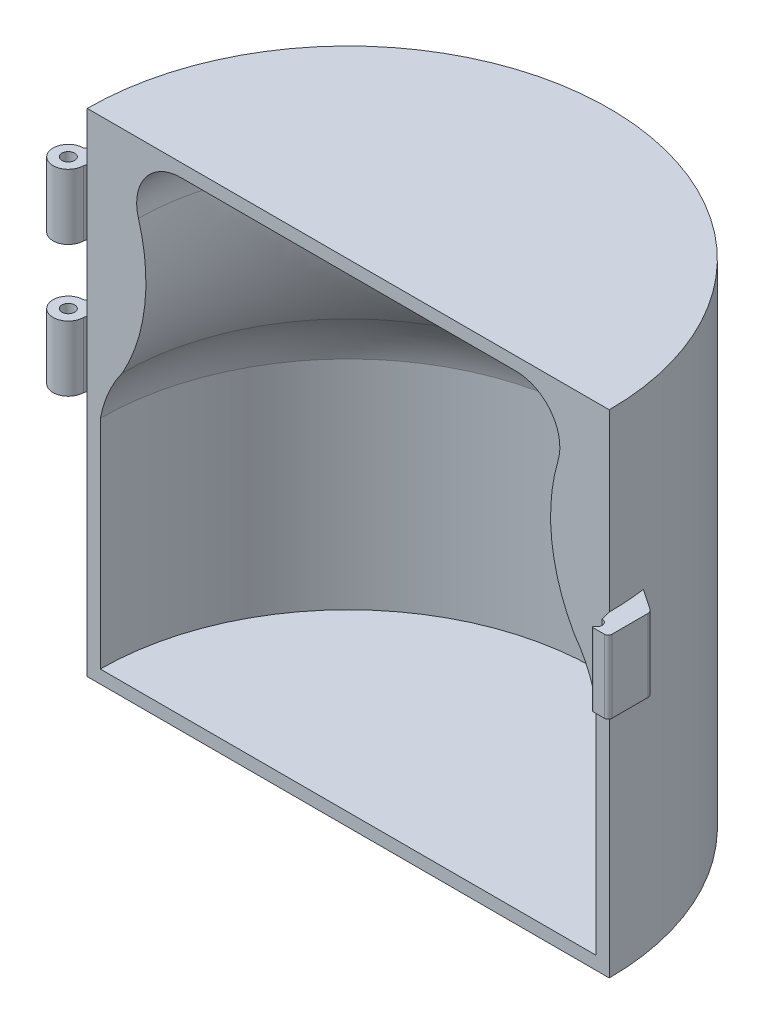
from build123d import *
from build123d.topology import SkipClean

# Parameters (mm, degrees)
REVOLVE1_ANGLE               = 180
BOSS_EXTRUDE1_DEPTH          = 22
BOSS_EXTRUDE1_DEPTH_BACK     = 5
SKETCH3_R                    = 0.875
BOSS_EXTRUDE2_DEPTH          = 5
BOSS_EXTRUDE2_DEPTH_BACK     = 5
SKETCH4_W                    = 4.7
SKETCH4_H                    = 9.1
CUT_REVOLVE1_ANGLE           = 9
CUT_REVOLVE1_OTHER_WAY_ANGLE = 9


with BuildPart() as part:
    # Sketch1 → Revolve1 (revolve)
    with BuildSketch(Plane.XY):
        with BuildLine():
            Line((0, 27.259159134), (23.011868121, 27.259159134))
            ThreePointArc((23.011868121, 27.259159134), (27.855738892, 24.833992365), (28.816239605, 19.502767713))
            ThreePointArc((28.816239605, 19.502767713), (27.949144344, 9.543519717), (31.011361688, 0.027149624))
            ThreePointArc((31.011361688, 0.027149624), (32.915416284, -3.265823742), (34.05, -6.89650099))
            Line((34.05, -6.89650099), (34.05, -36.726991211))
            Line((34.05, -36.726991211), (0, -36.726991211))
            Line((0, -36.726991211), (0, -38.526991211))
            Line((0, -38.526991211), (35.85, -38.526991211))
            Line((35.85, -38.526991211), (35.85, 29.059159134))
            Line((35.85, 29.059159134), (0, 29.059159134))
            Line((0, 29.059159134), (0, 27.259159134))
        make_face()
    revolve(axis=Axis((0, 0, 0), (0, 1, 0)), revolution_arc=REVOLVE1_ANGLE)

    # Sketch3 → Boss-Extrude1 (add, two sides: drawn at the far end of the back side and taken through both)
    with BuildSketch(Plane(origin=(0, 0, 0), x_dir=(1, 0, 0), z_dir=(0, 1, 0)).offset(-BOSS_EXTRUDE1_DEPTH_BACK)):
        with BuildLine():
            Line((-35.835435362, 1.02179861), (-35.66522342, 1.724252792))
            Line((-35.66522342, 1.724252792), (-35.552792373, 4.606674994))
            ThreePointArc((-35.552792373, 4.606674994), (-36.966498022, 3.313002301), (-38.45, 2.1))
            ThreePointArc((-38.45, 2.1), (-39.934924016, -1.484924465), (-36.35, 6.34e-07))
            ThreePointArc((-36.35, 6.34e-07), (-36.156829024, 0.54318529), (-35.835435362, 1.02179861))
        make_face()
        with Locations(Location((-38.45, 0, 0), (0, 0, 270))):
            Circle(SKETCH3_R, mode=Mode.SUBTRACT)
    extrude(amount=BOSS_EXTRUDE1_DEPTH + BOSS_EXTRUDE1_DEPTH_BACK)

    # Sketch5 → Boss-Extrude2 (add, two sides: drawn at the far end of the back side and taken through both)
    with BuildSketch(Plane(origin=(0, 0, 0), x_dir=(1, 0, 0), z_dir=(0, 1, 0)).offset(-BOSS_EXTRUDE2_DEPTH_BACK)):
        with BuildLine():
            Line((36.194622224, -1.309022975), (35.85, 0))
            ThreePointArc((35.85, 0), (35.761021608, 2.524249113), (35.494528112, 5.035968037))
            Line((35.494528112, 5.035968037), (38.337267345, 3.105755306))
            ThreePointArc((38.337267345, 3.105755306), (38.578712242, 2.836355157), (38.665960295, 2.485271326))
            Line((38.665960295, 2.485271326), (38.665960295, -2.467611774))
            ThreePointArc((38.665960295, -2.467611774), (38.519513686, -2.821165165), (38.165960295, -2.967611774))
            Line((38.165960295, -2.967611774), (37.169410283, -2.967611774))
            Line((37.169410283, -2.967611774), (36.551786147, -2.967611774))
            ThreePointArc((36.551786147, -2.967611774), (36.48188919, -2.945153638), (36.438154821, -2.886185362))
            Line((36.438154821, -2.886185362), (36.415143378, -2.818397505))
            ThreePointArc((36.415143378, -2.818397505), (36.933237669, -1.971906955), (36.194622224, -1.309022975))
        make_face()
    extrude(amount=BOSS_EXTRUDE2_DEPTH + BOSS_EXTRUDE2_DEPTH_BACK)

    # Sketch4 → Cut-Revolve1 (revolve, cut)
    with BuildSketch(Plane.XY):
        with Locations((-38.2, 8.5)):
            Rectangle(SKETCH4_W, SKETCH4_H)
    revolve(axis=Axis((0, 0, 0), (0, 1, 0)), revolution_arc=CUT_REVOLVE1_ANGLE, mode=Mode.SUBTRACT)

    # Sketch4 → Cut-Revolve1 other way (revolve, cut)
    with SkipClean():  # the faces are left unmerged after this step: merging them gives an invalid solid
        with BuildSketch(Plane.XY):
            with Locations((-38.2, 8.5)):
                Rectangle(SKETCH4_W, SKETCH4_H)
        revolve(axis=Axis((0, 0, 0), (0, -1, 0)), revolution_arc=CUT_REVOLVE1_OTHER_WAY_ANGLE, mode=Mode.SUBTRACT)


solid = part.part
